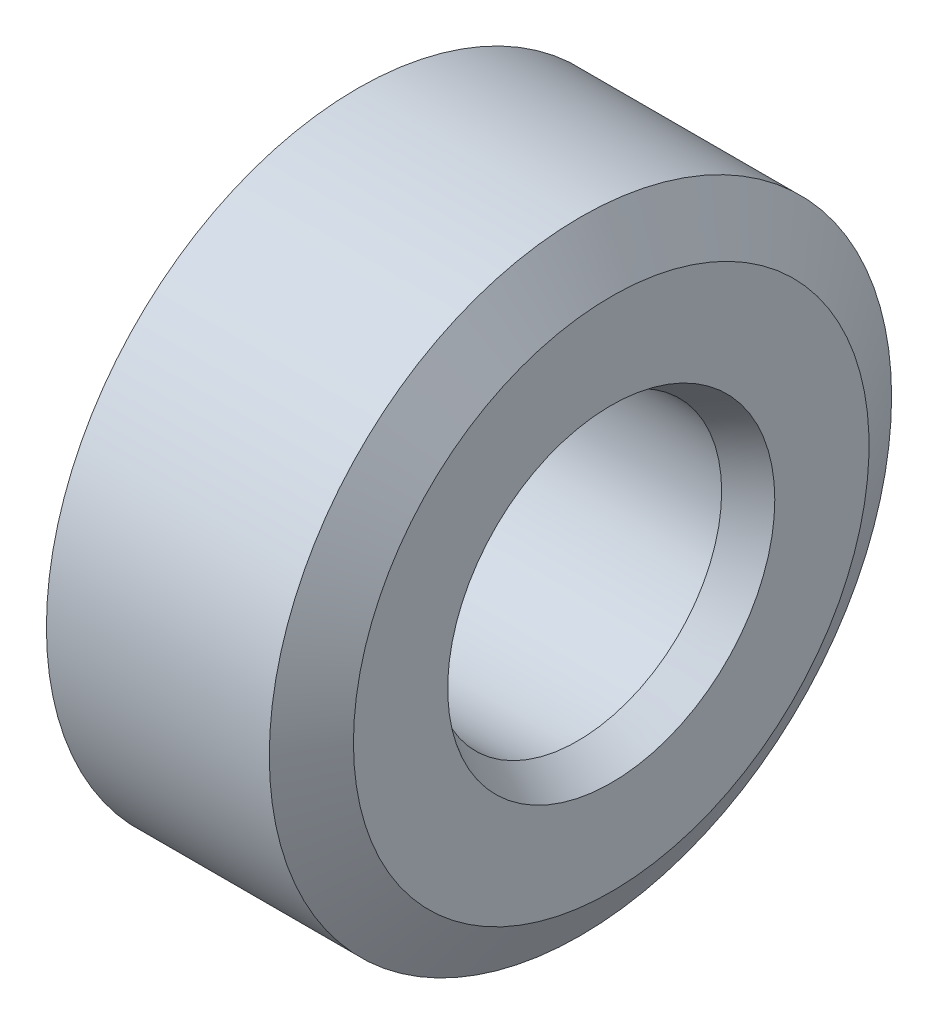
from build123d import *
from OCP.BRepFilletAPI import BRepFilletAPI_MakeChamfer

# Parameters (mm, degrees)
M3_CLEARANCE_HOLE1_D = 3.242
CHAMFER1_SIZE        = 0.378886114
CHAMFER1_SIZE2       = 0.21875
CHAMFER2_SIZE        = 2.507183156
CHAMFER2_SIZE2       = 2.507184174


with BuildPart() as part:
    # Sketch1 → Revolve1 (revolve)
    with BuildSketch(Plane(origin=(0, 0, 0), x_dir=(-1, 0, 0), z_dir=(0, 0, -1)), mode=Mode.PRIVATE) as revolve1_sk:
        Polygon((-3.2, 2.9), (-3.2, 0), (0, 0), (0, 2.9), (-1.6, 5.671281292), align=None)
    revolve(revolve1_sk.sketch.rotate(Axis((3.2, 0, 0), (-1, 0, 0)), 270), axis=Axis((3.2, 0, 0), (-1, 0, 0)))

    # M3 Clearance Hole1 (through all)
    with Locations(Plane.ZY):
        with Locations((0, 0)):
            Hole(M3_CLEARANCE_HOLE1_D / 2)

    # Chamfer1: one chamfer whose edges measure the first distance from different faces: ONE call of the kernel's chamfer builder (chamfer() names one face for all edges)
    chamfer1_edges_1 = [part.edges().sort_by_distance(p)[0] for p in [
        (0, 0, 1.621),
    ]]
    chamfer1_side_1 = [part.faces().sort_by_distance(p)[0] for p in [
        (0, 0, -2.817975613),
    ]]
    chamfer1_edges_2 = [part.edges().sort_by_distance(p)[0] for p in [
        (3.2, 0, 1.621),
    ]]
    chamfer1_side_2 = [part.faces().sort_by_distance(p)[0] for p in [
        (1.6, 0, 1.621),
    ]]
    chamfer1 = BRepFilletAPI_MakeChamfer(part.part.solid().wrapped)
    for e in chamfer1_edges_1:
        chamfer1.Add(CHAMFER1_SIZE, CHAMFER1_SIZE2, e.wrapped, chamfer1_side_1[0].wrapped)  # the first distance lies on this face
    for e in chamfer1_edges_2:
        chamfer1.Add(CHAMFER1_SIZE, CHAMFER1_SIZE2, e.wrapped, chamfer1_side_2[0].wrapped)  # the first distance lies on this face
    add(Compound.cast(chamfer1.Shape()), mode=Mode.REPLACE)

    # Chamfer2
    chamfer2_edges = [part.edges().sort_by_distance(p)[0] for p in [
        (1.6, 0, -5.671281292),
    ]]
    chamfer2_side = [part.faces().sort_by_distance(p)[0] for p in [
        (2.4, 0, -4.285640646),
    ]]
    chamfer(chamfer2_edges, length=CHAMFER2_SIZE, length2=CHAMFER2_SIZE2, reference=chamfer2_side[0])


solid = part.part
